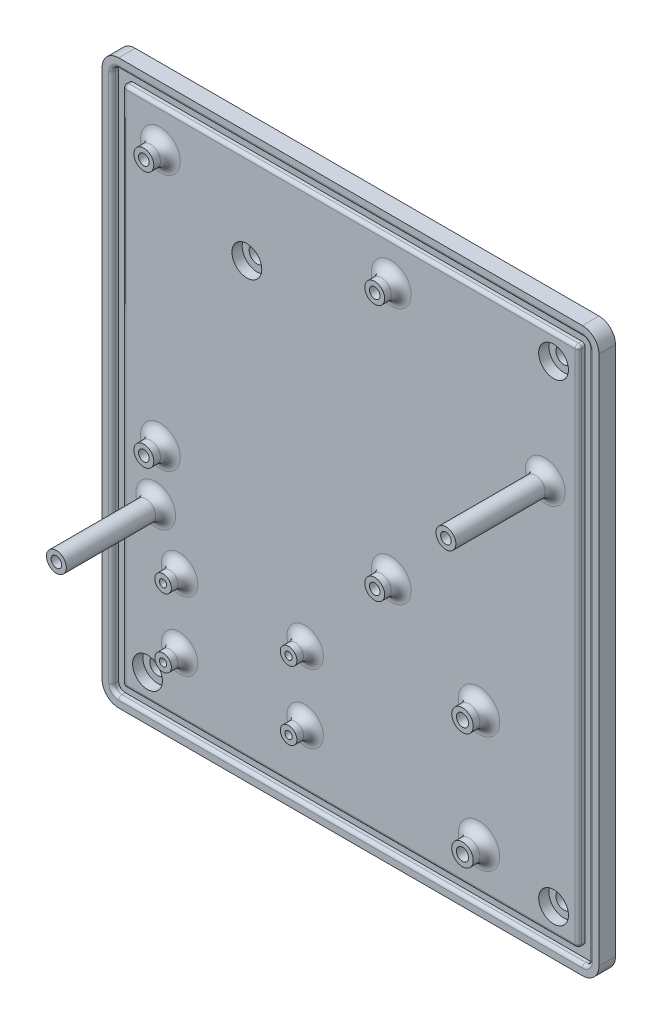
from build123d import *

# Parameters (mm, degrees)
RESSALTO_EXTRUS_O1_DEPTH                            = 5
ESBO_O5_W                                           = 137.6
ESBO_O5_H                                           = 157.6
CORTE_EXTRUS_O1_DEPTH                               = 2
FILETE2_R                                           = 1
FILETE4_R                                           = 1
ESBO_O6_R                                           = 3
ESBO_O6_R_2                                         = 3.25
ESBO_O6_R_3                                         = 2.5
RESSALTO_EXTRUS_O3_DEPTH                            = 5
ESBO_O18_R                                          = 3
RESSALTO_EXTRUS_O4_DEPTH                            = 30
FILETE5_R                                           = 3
FURO_COM_FOLGA_DE_M3_51_D                           = 3.7
FURO_COM_FOLGA_DE_M21_D                             = 2.2
FURO_COM_FOLGA_DE_M31_D                             = 3.2
REBAIXO_PARA_PARAFUSO_COM_CABE_A_PANELA_D           = 4.8
REBAIXO_PARA_PARAFUSO_COM_CABE_A_PANELA_CBORE_D     = 9
REBAIXO_PARA_PARAFUSO_COM_CABE_A_PANELA_CBORE_DEPTH = 3.1
FILETE6_R                                           = 1
FURO_COM_FOLGA_DE_M32_D                             = 3.2
FURO_COM_FOLGA_DE_M32_DEPTH                         = 15
FURO_COM_FOLGA_DE_M32_TIP                           = 0.96137699


with BuildPart() as part:
    # Esboço1 → Ressalto-extrusão1 (new body)
    with BuildSketch(Plane.XY):
        with BuildLine():
            Line((0, -5), (140, -5))
            ThreePointArc((140, -5), (143.535533906, -3.535533906), (145, 0))
            Line((145, 0), (145, 160))
            ThreePointArc((145, 160), (143.535533906, 163.535533906), (140, 165))
            Line((140, 165), (0, 165))
            ThreePointArc((0, 165), (-3.535533906, 163.535533906), (-5, 160))
            Line((-5, 160), (-5, 0))
            ThreePointArc((-5, 0), (-3.535533906, -3.535533906), (0, -5))
        make_face()
    extrude(amount=RESSALTO_EXTRUS_O1_DEPTH)

    # Esboço5 → Corte-extrusão1 (cut)
    with BuildSketch(Plane.XY.offset(5)):
        with BuildLine():
            Line((142, 0), (142, 160))
            ThreePointArc((142, 160), (141.414213562, 161.414213562), (140, 162))
            Line((140, 162), (0, 162))
            ThreePointArc((0, 162), (-1.414213562, 161.414213562), (-2, 160))
            Line((-2, 160), (-2, 0))
            ThreePointArc((-2, 0), (-1.414213562, -1.414213562), (0, -2))
            Line((0, -2), (140, -2))
            ThreePointArc((140, -2), (141.414213562, -1.414213562), (142, 0))
        make_face()
        with Locations((70, 80)):
            Rectangle(ESBO_O5_W, ESBO_O5_H, mode=Mode.SUBTRACT)
    extrude(amount=-CORTE_EXTRUS_O1_DEPTH, mode=Mode.SUBTRACT)

    # Filete2
    filete2_edges = [part.edges().sort_by_distance(p)[0] for p in [
        (141.414213562, -1.414213562, 5),
        (142, 80, 5),
        (141.414213562, 161.414213562, 5),
        (70, 162, 5),
        (-1.414213562, 161.414213562, 5),
        (-2, 80, 5),
        (-1.414213562, -1.414213562, 5),
        (70, -2, 5),
    ]]
    fillet(filete2_edges, radius=FILETE2_R)

    # Filete4
    filete4_edges = [part.edges().sort_by_distance(p)[0] for p in [
        (1.2, 1.2, 4),
        (1.2, 158.8, 4),
        (138.8, 158.8, 4),
        (138.8, 1.2, 4),
    ]]
    fillet(filete4_edges, radius=FILETE4_R)

    # Esboço6 → Ressalto-extrusão3 (add)
    with BuildSketch(Plane.XY.offset(5)):
        with Locations((12.6, 147.2)):
            Circle(ESBO_O6_R)
        with Locations((82.3, 147.2)):
            Circle(ESBO_O6_R)
        with Locations((82.3, 69.8)):
            Circle(ESBO_O6_R)
        with Locations((12.6, 69.8)):
            Circle(ESBO_O6_R)
        with Locations((108.8, 48.75)):
            Circle(ESBO_O6_R_2)
        with Locations((108.8, 13.65)):
            Circle(ESBO_O6_R_2)
        with Locations(Location((56.3, 18.6, 0), (0, 0, 180))):
            Circle(ESBO_O6_R_3)
        with Locations(Location((18.4, 39.3, 0), (0, 0, 180))):
            Circle(ESBO_O6_R_3)
        with Locations((18.4, 18.6)):
            Circle(ESBO_O6_R_3)
        with Locations((56.3, 39.3)):
            Circle(ESBO_O6_R_3)
    extrude(amount=RESSALTO_EXTRUS_O3_DEPTH)

    # Esboço18 → Ressalto-extrusão4 (add)
    with BuildSketch(Plane.XY.offset(5)):
        with Locations((128.8, 118.8)):
            Circle(ESBO_O18_R)
        with Locations((11.2, 53.8)):
            Circle(ESBO_O18_R)
    extrude(amount=RESSALTO_EXTRUS_O4_DEPTH)

    # Filete5
    filete5_edges = [part.edges().sort_by_distance(p)[0] for p in [
        (9.6, 147.2, 5),
        (79.3, 147.2, 5),
        (79.3, 69.8, 5),
        (9.6, 69.8, 5),
        (105.55, 48.75, 5),
        (105.55, 13.65, 5),
        (15.9, 18.6, 5),
        (58.8, 18.6, 5),
        (20.9, 39.3, 5),
        (53.8, 39.3, 5),
        (125.8, 118.8, 5),
        (8.2, 53.8, 5),
    ]]
    fillet(filete5_edges, radius=FILETE5_R)

    # Furo com folga de M3.51 (through all)
    with Locations(Plane.XY.offset(10)):
        with Locations((108.8, 13.65), (108.8, 48.75)):
            Hole(FURO_COM_FOLGA_DE_M3_51_D / 2)

    # Furo com folga de M21 (through all)
    with Locations(Plane.XY.offset(10)):
        with Locations((18.4, 39.3), (18.4, 18.6), (56.3, 39.3), (56.3, 18.6)):
            Hole(FURO_COM_FOLGA_DE_M21_D / 2)

    # Furo com folga de M31 (through all)
    with Locations(Plane.XY.offset(10)):
        with Locations((12.6, 147.2), (82.3, 147.2), (82.3, 69.8), (12.6, 69.8)):
            Hole(FURO_COM_FOLGA_DE_M31_D / 2)

    # Rebaixo para parafuso com cabeça panela de M41 (through all)
    with Locations(Plane.XY.offset(5)):
        with Locations((38.7, 131.3), (131.3, 151.3), (131.3, 8.7), (8.7, 8.7)):
            CounterBoreHole(REBAIXO_PARA_PARAFUSO_COM_CABE_A_PANELA_D / 2, REBAIXO_PARA_PARAFUSO_COM_CABE_A_PANELA_CBORE_D / 2, REBAIXO_PARA_PARAFUSO_COM_CABE_A_PANELA_CBORE_DEPTH)

    # Filete6
    filete6_edges = [part.edges().sort_by_distance(p)[0] for p in [
        (138.8, 80, 5),
        (1.2, 80, 5),
        (70, 1.2, 5),
        (70, 158.8, 5),
        (1.492893219, 158.507106781, 5),
        (1.492893219, 1.492893219, 5),
        (138.507106781, 1.492893219, 5),
        (138.507106781, 158.507106781, 5),
    ]]
    fillet(filete6_edges, radius=FILETE6_R)

    # Furo com folga de M32
    with Locations(Plane.XY.offset(35)):
        with Locations((128.8, 118.8), (11.2, 53.8)):
            Hole(FURO_COM_FOLGA_DE_M32_D / 2, depth=FURO_COM_FOLGA_DE_M32_DEPTH)
            with Locations((0, 0, -(FURO_COM_FOLGA_DE_M32_DEPTH + FURO_COM_FOLGA_DE_M32_TIP / 2))):  # 118° drill point
                Cone(0, FURO_COM_FOLGA_DE_M32_D / 2, FURO_COM_FOLGA_DE_M32_TIP, mode=Mode.SUBTRACT)


solid = part.part
